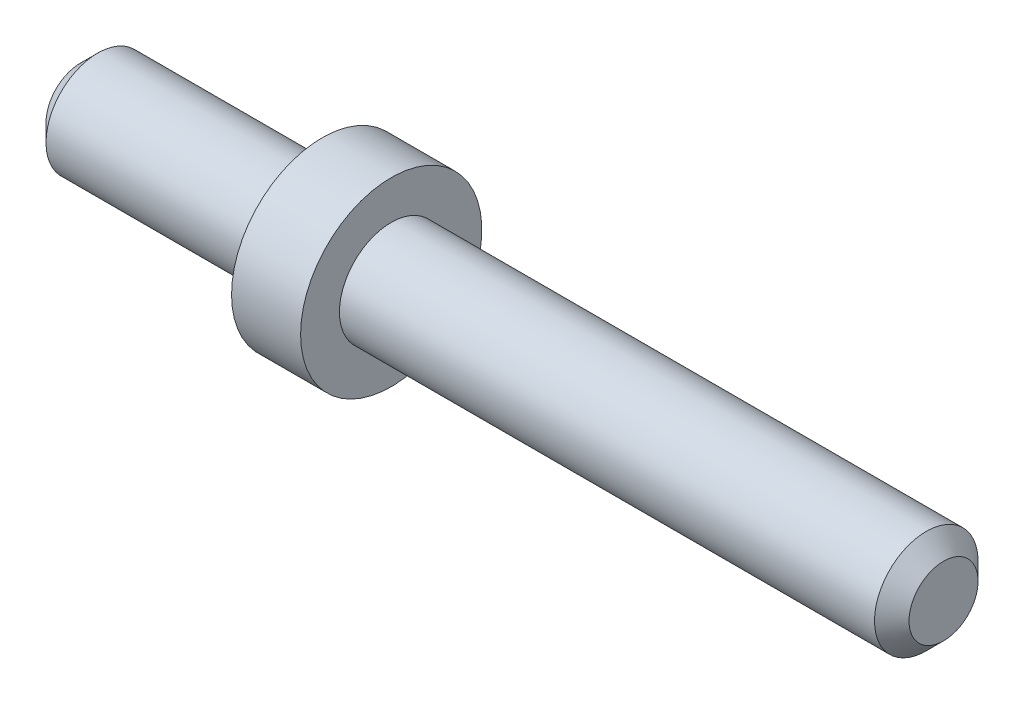
from build123d import *


with BuildPart() as part:
    # Эскиз1 → Повернуть1 (revolve)
    with BuildSketch(Plane.XY, mode=Mode.PRIVATE) as revolve_1_sk:
        Polygon((0, 0), (0, 2), (1, 3), (14, 3), (14, 5.25), (18, 5.25), (18, 3), (49, 3), (50, 2), (50, 0), align=None)
    revolve(revolve_1_sk.sketch.rotate(Axis((0, 0, 0), (1, 0, 0)), 90), axis=Axis((0, 0, 0), (1, 0, 0)))


solid = part.part
